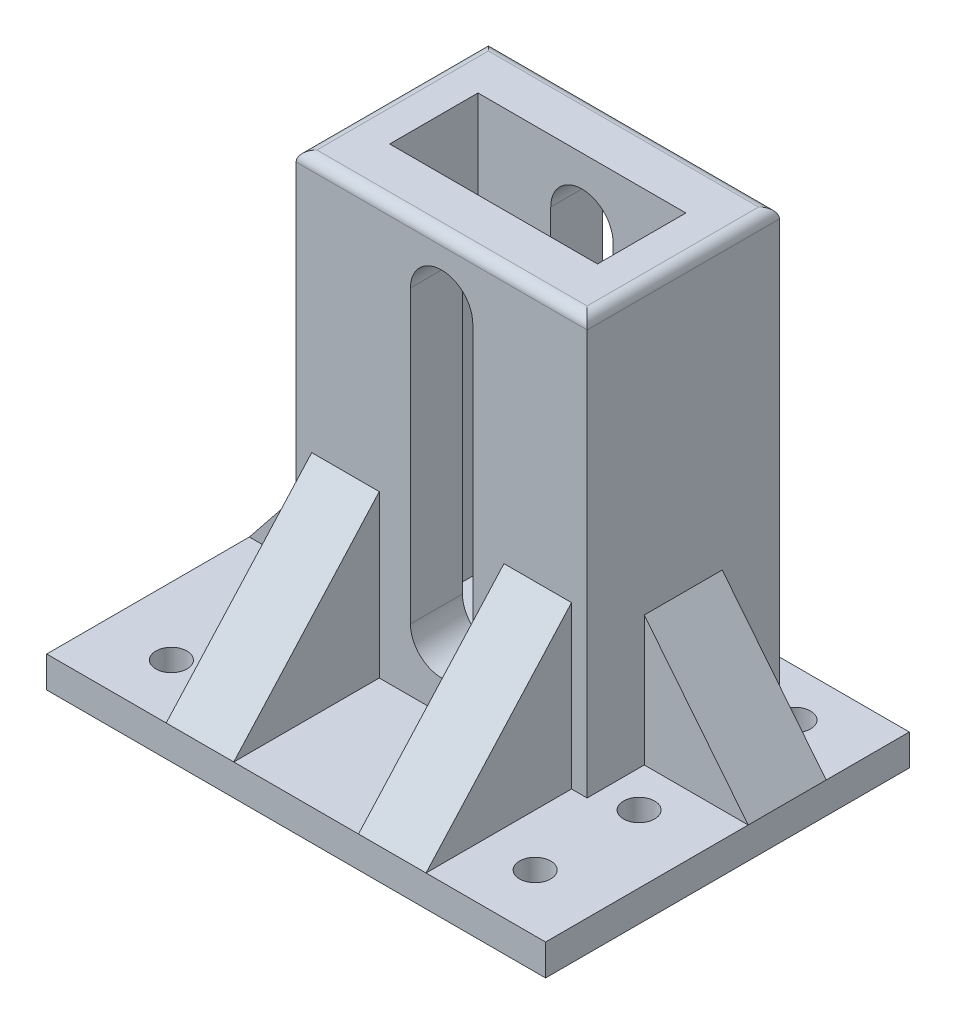
from build123d import *

# Parameters (mm, degrees)
SKETCH_1_W          = 96
SKETCH_1_H          = 70
SKETCH_1_R          = 3
EXTRUDE_1_DEPTH     = 6
SKETCH_2_W          = 56
SKETCH_2_H          = 37
SKETCH_2_W_2        = 40
SKETCH_2_H_2        = 17
EXTRUDE_2_DEPTH     = 80
EXTRUDE_3_DEPTH     = 7.5
EXTRUDE_4_DEPTH     = 25
CUT_EXTRUDE_1_DEPTH = 124.93663618
SKETCH_10_W         = 24
SKETCH_10_H         = 30.908347595
CUT_EXTRUDE_2_DEPTH = 80
FILLET_1_R          = 2


with BuildPart() as part:
    # 草图1 → 凸台-拉伸1 (new body)
    with BuildSketch(Plane(origin=(0, 0, 0), x_dir=(1, 0, 0), z_dir=(0, 1, 0))):
        with Locations((-13.149732523, 8.78973091)):
            Rectangle(SKETCH_1_W, SKETCH_1_H)
        with Locations(Location((21.850267477, 4.78973091, 0), (0, 0, 270))):
            Circle(SKETCH_1_R, mode=Mode.SUBTRACT)
        with Locations(Location((-48.149732523, 4.78973091, 0), (0, 0, 270))):
            Circle(SKETCH_1_R, mode=Mode.SUBTRACT)
        with Locations(Location((21.850267477, -15.21026909, 0), (0, 0, 270))):
            Circle(SKETCH_1_R, mode=Mode.SUBTRACT)
        with Locations(Location((-48.149732523, -15.21026909, 0), (0, 0, 270))):
            Circle(SKETCH_1_R, mode=Mode.SUBTRACT)
        with Locations(Location((21.850267477, 34.78973091, 0), (0, 0, 270))):
            Circle(SKETCH_1_R, mode=Mode.SUBTRACT)
        with Locations(Location((-48.149732523, 34.78973091, 0), (0, 0, 270))):
            Circle(SKETCH_1_R, mode=Mode.SUBTRACT)
    extrude(amount=EXTRUDE_1_DEPTH)

    # 草图2 → 凸台-拉伸2 (add)
    with BuildSketch(Plane(origin=(0, 6, 0), x_dir=(1, 0, 0), z_dir=(0, 1, 0))):
        with Locations((-13.149732523, 20.28973091)):
            Rectangle(SKETCH_2_W, SKETCH_2_H)
        with Locations((-13.149732523, 20.28973091)):
            Rectangle(SKETCH_2_W_2, SKETCH_2_H_2, mode=Mode.SUBTRACT)
    extrude(amount=EXTRUDE_2_DEPTH)

    # 草图5 → 凸台-拉伸3 (add, symmetric)
    with BuildSketch(Plane.XY.offset(-20.28973091)):
        Polygon((-61.149732523, 6), (-41.149732523, 31), (-41.149732523, 6), align=None)
        Polygon((14.850267477, 31), (34.850267477, 6), (14.850267477, 6), align=None)
    extrude(amount=EXTRUDE_3_DEPTH, both=True)

    # 草图8 → 凸台-拉伸4 (add, symmetric)
    with BuildSketch(Plane(origin=(-13.149732523, 0, 0), x_dir=(0, 0, -1), z_dir=(1, 0, 0))):
        Polygon((-26.21026909, 6), (1.78973091, 37.060621439), (1.78973091, 6), align=None)
    extrude(amount=EXTRUDE_4_DEPTH, both=True)

    # 草图9 → 切除-拉伸1 (cut, through all)
    with BuildSketch(Plane(origin=(0, 0, -38.78973091), x_dir=(-1, 0, 0), z_dir=(0, 0, -1))):
        with BuildLine():
            Line((19.149732523, 74), (19.149732523, 18))
            ThreePointArc((19.149732523, 18), (13.149732523, 12), (7.149732523, 18))
            Line((7.149732523, 18), (7.149732523, 74))
            ThreePointArc((7.149732523, 74), (13.149732523, 80), (19.149732523, 74))
        make_face()
    extrude(amount=-CUT_EXTRUDE_1_DEPTH, mode=Mode.SUBTRACT)

    # 草图10 → 切除-拉伸2 (cut)
    with BuildSketch(Plane(origin=(0, 86, 0), x_dir=(1, 0, 0), z_dir=(0, 1, 0))):
        with Locations((-13.149732523, -13.664442888)):
            Rectangle(SKETCH_10_W, SKETCH_10_H)
    extrude(amount=-CUT_EXTRUDE_2_DEPTH, mode=Mode.SUBTRACT)

    # 圆角1
    fillet_1_edges = [part.edges().sort_by_distance(p)[0] for p in [
        (14.850267477, 86, -20.28973091),
        (-13.149732523, 86, -38.78973091),
        (-41.149732523, 86, -20.28973091),
        (-13.149732523, 86, -1.78973091),
    ]]
    fillet(fillet_1_edges, radius=FILLET_1_R)


solid = part.part
